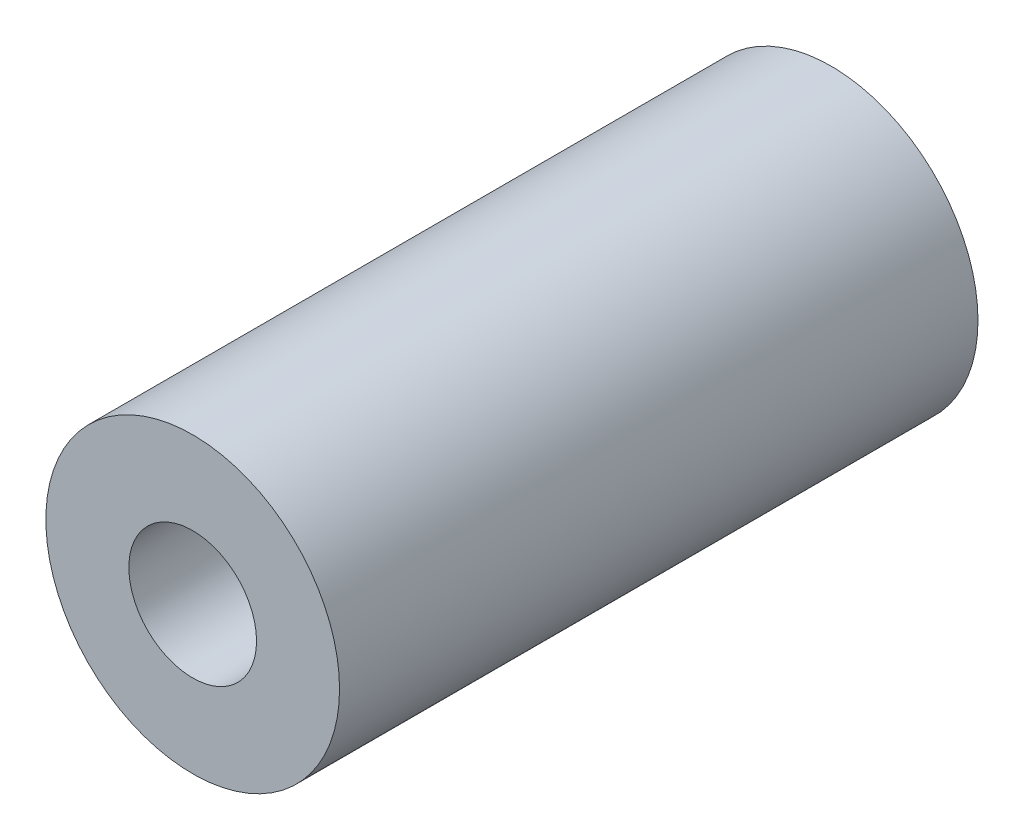
from build123d import *

# Parameters (mm, degrees)
SKETCH1_R           = 2.3
SKETCH1_R_2         = 1
BOSS_EXTRUDE1_DEPTH = 10


with BuildPart() as part:
    # Sketch1 → Boss-Extrude1 (new body)
    with BuildSketch(Plane.XY):
        Circle(SKETCH1_R)
        Circle(SKETCH1_R_2, mode=Mode.SUBTRACT)
    extrude(amount=BOSS_EXTRUDE1_DEPTH)


solid = part.part
